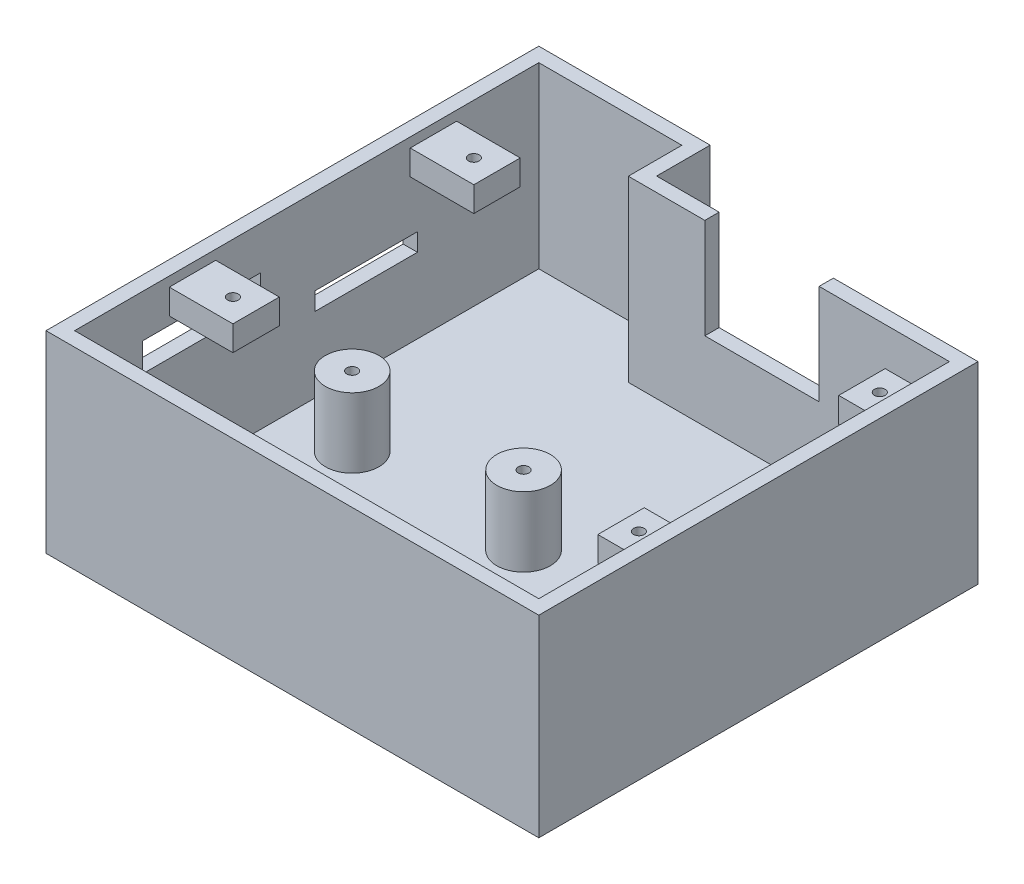
from build123d import *

# Parameters (mm, degrees)
BOSS_EXTRUDE1_DEPTH = 4
BOSS_EXTRUDE2_START = 4
BOSS_EXTRUDE2_DEPTH = 50
SKETCH3_R           = 7.5
SKETCH3_R_2         = 1.5
BOSS_EXTRUDE3_DEPTH = 19.5
SKETCH4_W           = 13
SKETCH4_H           = 7
BOSS_EXTRUDE4_DEPTH = 17.81
SKETCH5_W           = 13
SKETCH5_H           = 7
BOSS_EXTRUDE5_DEPTH = 10
CUT_EXTRUDE1_REACH  = 117.087
SKETCH6_R           = 1.5
CUT_EXTRUDE2_REACH  = 149.777
SKETCH7_W           = 32
SKETCH7_H           = 28
CUT_EXTRUDE3_REACH  = 165.476
SKETCH8_W           = 33
SKETCH8_H           = 8
SKETCH8_W_2         = 28.7
SKETCH8_H_2         = 5


with BuildPart() as part:
    # Sketch1 → Boss-Extrude1 (new body)
    with BuildSketch(Plane(origin=(0, 0, 0), x_dir=(1, 0, 0), z_dir=(0, 1, 0))):
        Polygon((-69, -61.5), (69, -61.5), (69, 61.5), (-21, 61.5), (-21, 76.5), (-69, 76.5), (-69, 61.5), align=None)
    extrude(amount=BOSS_EXTRUDE1_DEPTH)

    # Sketch1<5> → Boss-Extrude2 (add)
    with BuildSketch(Plane(origin=(0, 0, 0), x_dir=(1, 0, 0), z_dir=(0, 1, 0)).offset(BOSS_EXTRUDE2_START)):
        Polygon((-69, 61.5), (-69, -61.5), (69, -61.5), (69, 61.5), (-21, 61.5), (-21, 76.5), (-69, 76.5), align=None)
        Polygon((-65, -57.5), (-65, 57.5), (-65, 72.5), (-24.92925867, 72.5), (-24.92925867, 57.5), (65, 57.5), (65, -57.5), align=None, mode=Mode.SUBTRACT)
    extrude(amount=BOSS_EXTRUDE2_DEPTH)

    # Sketch3 → Boss-Extrude3 (add)
    # profile 1 of 2: a face of its own
    with BuildSketch(Plane(origin=(0, 4, 0), x_dir=(1, 0, 0), z_dir=(0, 1, 0))):
        with Locations(Location((-46.862948708, 2.10374449, 0), (0, 0, 270))):
            Circle(SKETCH3_R)
        with Locations(Location((-46.862948708, 2.10374449, 0), (0, 0, 270))):
            Circle(SKETCH3_R_2, mode=Mode.SUBTRACT)
    # profile 2 of 2: a face of its own
    with BuildSketch(Plane(origin=(0, 4, 0), x_dir=(1, 0, 0), z_dir=(0, 1, 0))):
        with Locations(Location((1.137051292, 2.10374449, 0), (0, 0, 270))):
            Circle(SKETCH3_R)
        with Locations(Location((1.137051292, 2.10374449, 0), (0, 0, 270))):
            Circle(SKETCH3_R_2, mode=Mode.SUBTRACT)
    extrude(amount=BOSS_EXTRUDE3_DEPTH)

    # Sketch4 → Boss-Extrude4 (add)
    with BuildSketch(Plane(origin=(-65, 0, 0), x_dir=(0, 0, -1), z_dir=(1, 0, 0))):
        with Locations((-24.47, 47.8)):
            Rectangle(SKETCH4_W, SKETCH4_H)
        with Locations((43, 47.8)):
            Rectangle(SKETCH4_W, SKETCH4_H)
    extrude(amount=BOSS_EXTRUDE4_DEPTH)

    # Sketch5 → Boss-Extrude5 (add)
    with BuildSketch(Plane.ZY.offset(-65)):
        with Locations((24.47, 47.8)):
            Rectangle(SKETCH5_W, SKETCH5_H)
        with Locations((-43, 47.8)):
            Rectangle(SKETCH5_W, SKETCH5_H)
    extrude(amount=BOSS_EXTRUDE5_DEPTH)

    # Sketch6 → Cut-Extrude1 (cut, up to next)
    with BuildSketch(Plane(origin=(0, 51.3, 0), x_dir=(1, 0, 0), z_dir=(0, 1, 0)), mode=Mode.PRIVATE) as cut_extrude1_sk1:
        with Locations(Location((-53.69, 43, 0), (0, 0, 270))):
            Circle(SKETCH6_R)
    cut_extrude1_tool1 = extrude(cut_extrude1_sk1.sketch, amount=-CUT_EXTRUDE1_REACH, mode=Mode.PRIVATE) & part.part
    # Sketch6 → Cut-Extrude1 (cut, up to next)
    with BuildSketch(Plane(origin=(0, 51.3, 0), x_dir=(1, 0, 0), z_dir=(0, 1, 0)), mode=Mode.PRIVATE) as cut_extrude1_sk2:
        with Locations(Location((-53.69, -24.47, 0), (0, 0, 270))):
            Circle(SKETCH6_R)
    cut_extrude1_tool2 = extrude(cut_extrude1_sk2.sketch, amount=-CUT_EXTRUDE1_REACH, mode=Mode.PRIVATE) & part.part
    # Sketch6 → Cut-Extrude1 (cut, up to next)
    with BuildSketch(Plane(origin=(0, 51.3, 0), x_dir=(1, 0, 0), z_dir=(0, 1, 0)), mode=Mode.PRIVATE) as cut_extrude1_sk3:
        with Locations(Location((60, -24.47, 0), (0, 0, 270))):
            Circle(SKETCH6_R)
    cut_extrude1_tool3 = extrude(cut_extrude1_sk3.sketch, amount=-CUT_EXTRUDE1_REACH, mode=Mode.PRIVATE) & part.part
    # Sketch6 → Cut-Extrude1 (cut, up to next)
    with BuildSketch(Plane(origin=(0, 51.3, 0), x_dir=(1, 0, 0), z_dir=(0, 1, 0)), mode=Mode.PRIVATE) as cut_extrude1_sk4:
        with Locations(Location((60, 43, 0), (0, 0, 270))):
            Circle(SKETCH6_R)
    cut_extrude1_tool4 = extrude(cut_extrude1_sk4.sketch, amount=-CUT_EXTRUDE1_REACH, mode=Mode.PRIVATE) & part.part
    add(cut_extrude1_tool1.solids().sort_by_distance((-53.69, 51.3, -43))[0], mode=Mode.SUBTRACT)
    add(cut_extrude1_tool2.solids().sort_by_distance((-53.69, 51.3, 24.47))[0], mode=Mode.SUBTRACT)
    add(cut_extrude1_tool3.solids().sort_by_distance((60, 51.3, 24.47))[0], mode=Mode.SUBTRACT)
    add(cut_extrude1_tool4.solids().sort_by_distance((60, 51.3, -43))[0], mode=Mode.SUBTRACT)

    # Sketch7 → Cut-Extrude2 (cut, up to next)
    with BuildSketch(Plane.XY.offset(-57.5), mode=Mode.PRIVATE) as cut_extrude2_sk1:
        with Locations((12.5, 40)):
            Rectangle(SKETCH7_W, SKETCH7_H)
    cut_extrude2_tool1 = extrude(cut_extrude2_sk1.sketch, amount=-CUT_EXTRUDE2_REACH, mode=Mode.PRIVATE) & part.part
    add(cut_extrude2_tool1.solids().sort_by_distance((12.5, 40, -57.5))[0], mode=Mode.SUBTRACT)

    # Sketch8 → Cut-Extrude3 (cut, up to next)
    with BuildSketch(Plane(origin=(-65, 0, 0), x_dir=(0, 0, -1), z_dir=(1, 0, 0)), mode=Mode.PRIVATE) as cut_extrude3_sk1:
        with Locations((-22, 38)):
            Rectangle(SKETCH8_W, SKETCH8_H)
    cut_extrude3_tool1 = extrude(cut_extrude3_sk1.sketch, amount=-CUT_EXTRUDE3_REACH, mode=Mode.PRIVATE) & part.part
    # Sketch8 → Cut-Extrude3 (cut, up to next)
    with BuildSketch(Plane(origin=(-65, 0, 0), x_dir=(0, 0, -1), z_dir=(1, 0, 0)), mode=Mode.PRIVATE) as cut_extrude3_sk2:
        with Locations((24.167352626, 27.5)):
            Rectangle(SKETCH8_W_2, SKETCH8_H_2)
    cut_extrude3_tool2 = extrude(cut_extrude3_sk2.sketch, amount=-CUT_EXTRUDE3_REACH, mode=Mode.PRIVATE) & part.part
    add(cut_extrude3_tool1.solids().sort_by_distance((-65, 38, 22))[0], mode=Mode.SUBTRACT)
    add(cut_extrude3_tool2.solids().sort_by_distance((-65, 27.5, -24.167353))[0], mode=Mode.SUBTRACT)


solid = part.part
